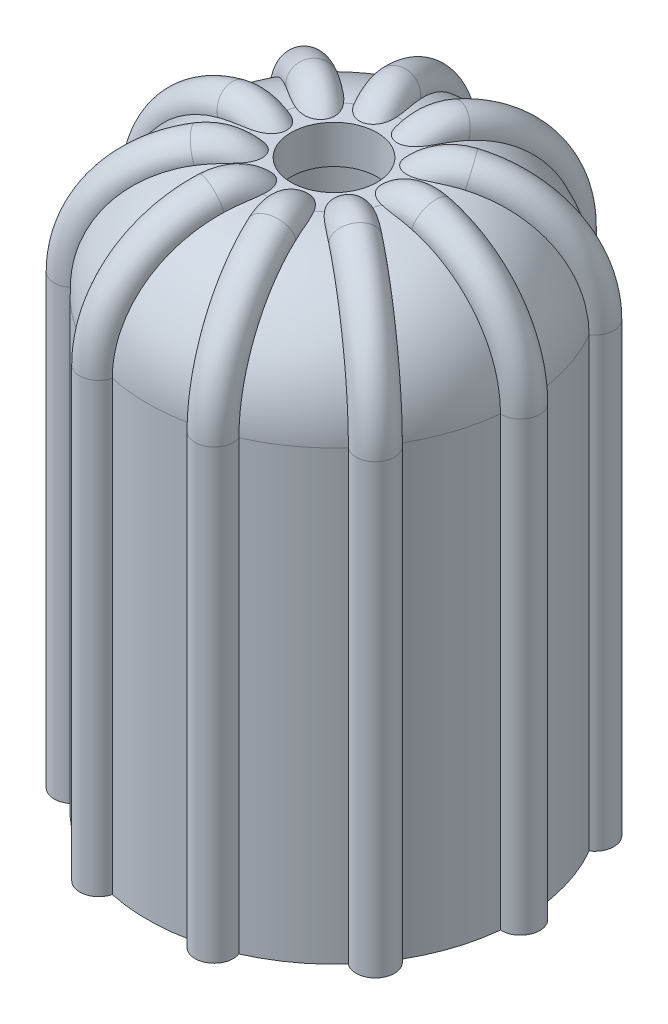
from build123d import *

# Parameters (mm, degrees)
SKETCH_3_R               = 1
PATTERN_CIRCULAR_1_COUNT = 10


with BuildPart() as part:
    # Эскиз1 → Повернуть1 (revolve)
    with BuildSketch(Plane.XY, mode=Mode.PRIVATE) as revolve_1_sk:
        with BuildLine():
            Line((-3.5, 21.6), (-3.5, 27.6))
            Line((-3.5, 27.6), (-2.25, 27.6))
            Line((-2.25, 27.6), (-2.25, 29.6))
            Line((-2.25, 29.6), (-3.5, 29.6))
            ThreePointArc((-3.5, 29.6), (-7.919417382, 27.769417382), (-9.75, 23.35))
            Line((-9.75, 23.35), (-9.75, 0))
            Line((-9.75, 0), (-8.75, 0))
            Line((-8.75, 0), (-8.75, 20))
            Line((-8.75, 20), (-6.25, 20))
            Line((-6.25, 20), (-6.25, 21.6))
            Line((-6.25, 21.6), (-3.5, 21.6))
        make_face()
    revolve(revolve_1_sk.sketch.rotate(Axis((0, 0, 0), (0, 1, 0)), 270), axis=Axis((0, 0, 0), (0, 1, 0)))

    # По траектории1: sweep along a path in Эскиз2
    with BuildLine(Plane.XY) as sweep_1_path:
        Line((-9.75, 0), (-9.75, 23.35))
        ThreePointArc((-9.75, 23.35), (-8.445041821, 27.172180188), (-5.075100355, 29.398269081))
        ThreePointArc((-5.075100355, 29.398269081), (-4.027210082, 29.387457564), (-3.128634831, 28.848241993))
    # Эскиз3 → По траектории1 (sweep)
    with BuildSketch(Plane(origin=(0, 0, 0), x_dir=(-1, 0, 0), z_dir=(0, -1, 0))):
        with Locations((9.75, 0)):
            Circle(SKETCH_3_R)
    sweep_1 = sweep(path=sweep_1_path.line)

    # Круговой массив1: По траектории1 ×10 about axis
    pattern_circular_1_axis = Axis((0, 0, 0), (0, 1, 0))
    for i in range(1, PATTERN_CIRCULAR_1_COUNT):
        add(sweep_1.rotate(pattern_circular_1_axis, i * 360 / PATTERN_CIRCULAR_1_COUNT))


solid = part.part
